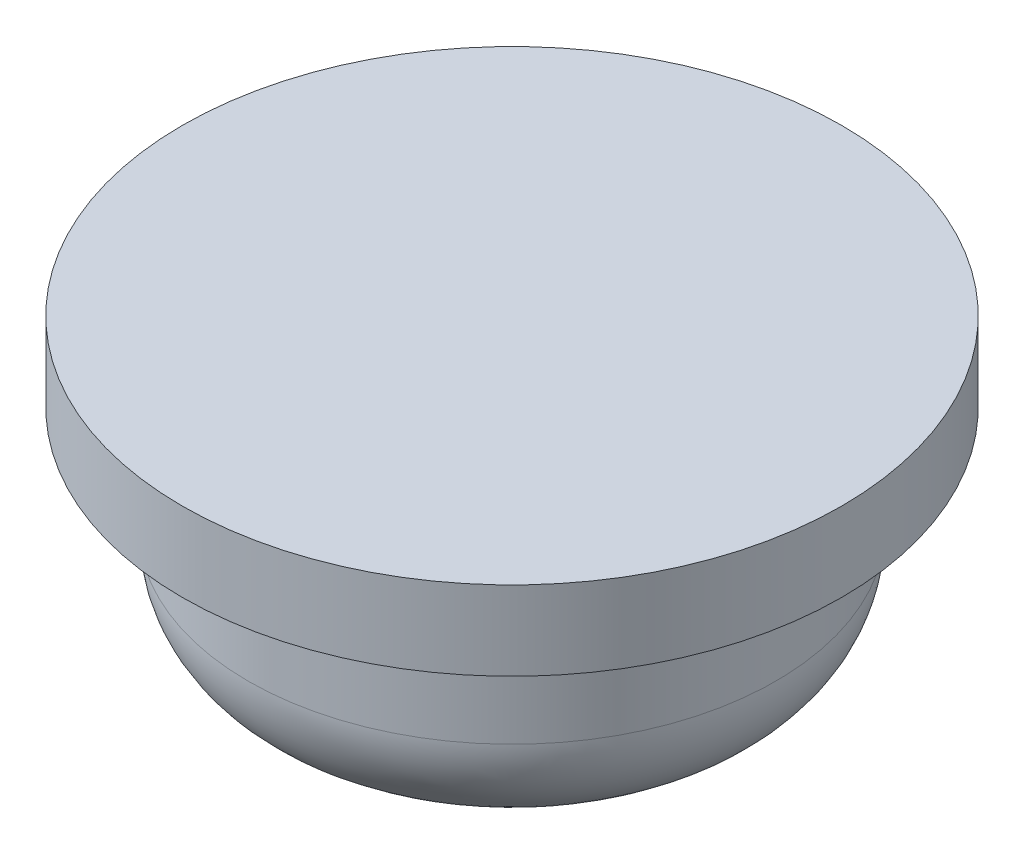
from build123d import *

# Parameters (mm, degrees)
SKETCH_1_R      = 2
EXTRUDE_1_DEPTH = 1.6
SKETCH_2_R      = 2.5
SKETCH_2_R_2    = 2
EXTRUDE_2_DEPTH = 0.6
FILLET_1_R      = 0.8


with BuildPart() as part:
    # Эскиз1 → Бобышка-Вытянуть1 (new body)
    with BuildSketch(Plane(origin=(0, 0, 0), x_dir=(1, 0, 0), z_dir=(0, 1, 0))):
        with Locations(Location((0, 0, 0), (0, 0, 270))):
            Circle(SKETCH_1_R)
    extrude(amount=EXTRUDE_1_DEPTH)

    # Эскиз2 → Бобышка-Вытянуть2 (add)
    # profile 1 of 2: a face of its own
    with BuildSketch(Plane(origin=(0, 1.6, 0), x_dir=(1, 0, 0), z_dir=(0, 1, 0))):
        with Locations(Location((0, 0, 0), (0, 0, 270))):
            Circle(SKETCH_2_R)
        with Locations(Location((0, 0, 0), (0, 0, 270))):
            Circle(SKETCH_2_R_2, mode=Mode.SUBTRACT)
    # profile 2 of 2: a face of its own
    with BuildSketch(Plane(origin=(0, 1.6, 0), x_dir=(1, 0, 0), z_dir=(0, 1, 0))):
        with Locations(Location((0, 0, 0), (0, 0, 270))):
            Circle(SKETCH_2_R_2)
    extrude(amount=EXTRUDE_2_DEPTH)

    # Скругление1
    fillet_1_edges = [part.edges().sort_by_distance(p)[0] for p in [
        (0, 0, -2),
    ]]
    fillet(fillet_1_edges, radius=FILLET_1_R)


solid = part.part
